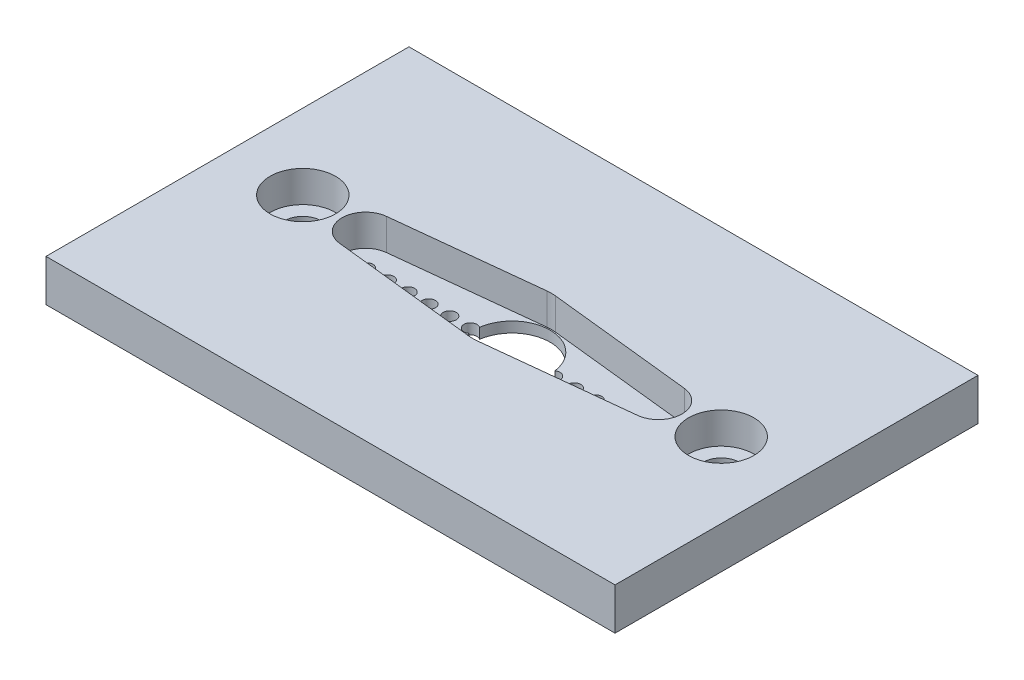
from build123d import *

# Parameters (mm, degrees)
SKETCH1_W           = 54.3999928
SKETCH1_H           = 34.7000068
BOSS_EXTRUDE1_DEPTH = 3.999992
SKETCH2_R           = 3.125000785
CUT_EXTRUDE1_DEPTH  = 2.999994
SKETCH7_R           = 1.7499965
CUT_EXTRUDE5_DEPTH  = 33.401579995
SKETCH8_R           = 0.621776252
SKETCH8_R_2         = 0.622309086
CUT_EXTRUDE6_DEPTH  = 33.509419529
CUT_EXTRUDE7_DEPTH  = 2.999994


with BuildPart() as part:
    # Sketch1 → Boss-Extrude1 (new body)
    with BuildSketch(Plane(origin=(0, 0, 0), x_dir=(1, 0, 0), z_dir=(0, 1, 0))):
        Rectangle(SKETCH1_W, SKETCH1_H)
    extrude(amount=BOSS_EXTRUDE1_DEPTH)

    # Sketch2 → Cut-Extrude1 (cut)
    with BuildSketch(Plane(origin=(0, 3.999992, 0), x_dir=(1, 0, 0), z_dir=(0, 1, 0))):
        with Locations(Location((-19.999997415, 0, 0), (0, 0, 270))):
            Circle(SKETCH2_R)
        with Locations(Location((19.999997415, 0, 0), (0, 0, 90))):
            Circle(SKETCH2_R)
    extrude(amount=-CUT_EXTRUDE1_DEPTH, mode=Mode.SUBTRACT)

    # Sketch7 → Cut-Extrude5 (cut, through all)
    with BuildSketch(Plane(origin=(0, 0.999998, 0), x_dir=(1, 0, 0), z_dir=(0, 1, 0))):
        with Locations(Location((-19.999997415, 0, 0), (0, 0, 270))):
            Circle(SKETCH7_R)
        with Locations(Location((19.999997415, 0, 0), (0, 0, 90))):
            Circle(SKETCH7_R)
    extrude(amount=-CUT_EXTRUDE5_DEPTH, mode=Mode.SUBTRACT)

    # Sketch8 → Cut-Extrude6 (cut, through all)
    with BuildSketch(Plane(origin=(0, 3.999992, 0), x_dir=(1, 0, 0), z_dir=(0, 1, 0))):
        with Locations(Location((-13.914038205, -0.000532834, 0), (0, 0, 270))):
            Circle(SKETCH8_R)
        with Locations(Location((-11.925423769, 0, 0), (0, 0, 270))):
            Circle(SKETCH8_R_2)
        with Locations(Location((-9.936809177, -0.000532834, 0), (0, 0, 270))):
            Circle(SKETCH8_R)
        with Locations(Location((-7.948194741, 0, 0), (0, 0, 270))):
            Circle(SKETCH8_R_2)
        with Locations(Location((-5.959580149, -0.000532834, 0), (0, 0, 270))):
            Circle(SKETCH8_R)
        with BuildLine():
            ThreePointArc((3.60507443, 0.503380738), (4.593274799, 0), (3.60507443, -0.503380738))
            ThreePointArc((3.60507443, -0.503380738), (0, -3.6400486), (-3.60507443, -0.503380738))
            ThreePointArc((-3.60507443, -0.503380738), (-4.593274799, 0), (-3.60507443, 0.503380738))
            ThreePointArc((-3.60507443, 0.503380738), (0, 3.6400486), (3.60507443, 0.503380738))
        make_face()
        with Locations(Location((5.959580149, -0.000532834, 0), (0, 0, 270))):
            Circle(SKETCH8_R)
        with Locations(Location((9.936809177, -0.000532834, 0), (0, 0, 270))):
            Circle(SKETCH8_R)
        with Locations(Location((7.948194741, 0, 0), (0, 0, 270))):
            Circle(SKETCH8_R_2)
        with Locations(Location((11.925423769, 0, 0), (0, 0, 270))):
            Circle(SKETCH8_R_2)
        with Locations(Location((13.914038205, -0.000532834, 0), (0, 0, 270))):
            Circle(SKETCH8_R)
    extrude(amount=-CUT_EXTRUDE6_DEPTH, mode=Mode.SUBTRACT)

    # Sketch9 → Cut-Extrude7 (cut)
    with BuildSketch(Plane(origin=(0, 3.999992, 0), x_dir=(1, 0, 0), z_dir=(0, 1, 0))):
        with BuildLine():
            Line((-14.2410688, 2.2370542), (-0.4017772, 3.7338))
            ThreePointArc((-0.4017772, 3.7338), (0, 3.755463322), (0.4017772, 3.7338))
            Line((0.4017772, 3.7338), (14.2410688, 2.2370542))
            ThreePointArc((14.2410688, 2.2370542), (16.250002136, 0), (14.2410688, -2.2370542))
            Line((14.2410688, -2.2370542), (0.4017772, -3.7338))
            ThreePointArc((0.4017772, -3.7338), (0, -3.755463322), (-0.4017772, -3.7338))
            Line((-0.4017772, -3.7338), (-14.2410688, -2.2370542))
            ThreePointArc((-14.2410688, -2.2370542), (-16.250002136, 0), (-14.2410688, 2.2370542))
        make_face()
    extrude(amount=-CUT_EXTRUDE7_DEPTH, mode=Mode.SUBTRACT)


solid = part.part
